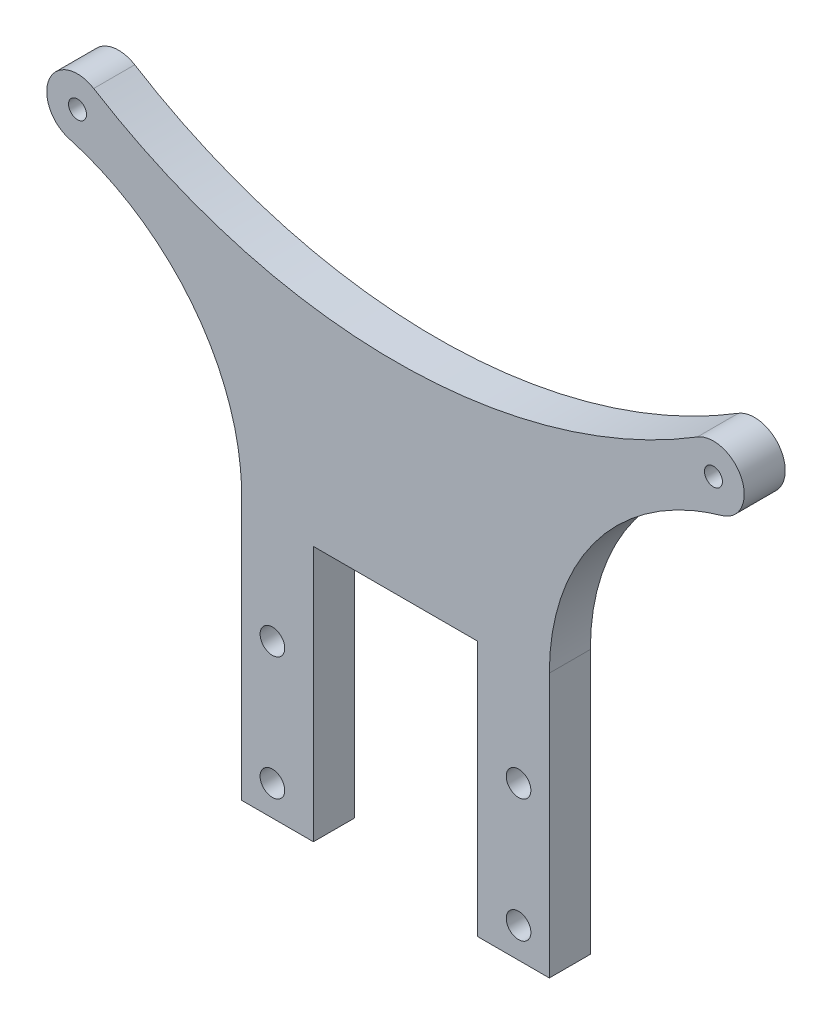
from build123d import *

# Parameters (mm, degrees)
SKETCH1_R           = 1.905
SKETCH1_R_2         = 1.3890625
BOSS_EXTRUDE1_DEPTH = 6.35


with BuildPart() as part:
    # Sketch1 → Boss-Extrude1 (new body)
    with BuildSketch(Plane.XY):
        with BuildLine():
            Line((12.7, 0), (-12.7, 0))
            Line((-12.7, 0), (-12.7, -39.593860647))
            Line((-12.7, -39.593860647), (-23.8125, -39.593860647))
            Line((-23.8125, -39.593860647), (-23.8125, 1.27))
            add(Edge.make_bspline(
                [(-23.8125, 1.27), (-23.8125, 28.224807165), (-50.502986928, 35.738173469)],
                knots=[0, 0, 0, 1.28831511, 1.28831511, 1.28831511], degree=2, weights=[1, 0.79960596, 1]))
            ThreePointArc((-50.502986928, 35.738173469), (-53.573053894, 42.237434983), (-46.71026588, 44.374688379))
            ThreePointArc((-46.71026588, 44.374688379), (0, 31.115), (46.71026588, 44.374688379))
            ThreePointArc((46.71026588, 44.374688379), (53.573053894, 42.237434983), (50.502986928, 35.738173469))
            add(Edge.make_bspline(
                [(50.502986928, 35.738173469), (23.8125, 28.224807165), (23.8125, 1.27)],
                knots=[1.853277544, 1.853277544, 1.853277544, 3.141592654, 3.141592654, 3.141592654], degree=2, weights=[1, 0.79960596, 1]))
            Line((23.8125, 1.27), (23.8125, -5.08))
            Line((23.8125, -5.08), (23.8125, -39.593860647))
            Line((23.8125, -39.593860647), (12.7, -39.593860647))
            Line((12.7, -39.593860647), (12.7, 0))
        make_face()
        with Locations((-19.05, -15.875)):
            Circle(SKETCH1_R, mode=Mode.SUBTRACT)
        with Locations(Location((19.05, -15.875, 0), (0, 0, 180))):
            Circle(SKETCH1_R, mode=Mode.SUBTRACT)
        with Locations((-49.2125, 40.3225)):
            Circle(SKETCH1_R_2, mode=Mode.SUBTRACT)
        with Locations((-19.05, -34.925)):
            Circle(SKETCH1_R, mode=Mode.SUBTRACT)
        with Locations(Location((19.05, -34.925, 0), (0, 0, 180))):
            Circle(SKETCH1_R, mode=Mode.SUBTRACT)
        with Locations(Location((49.2125, 40.3225, 0), (0, 0, 180))):
            Circle(SKETCH1_R_2, mode=Mode.SUBTRACT)
    extrude(amount=BOSS_EXTRUDE1_DEPTH)


solid = part.part
